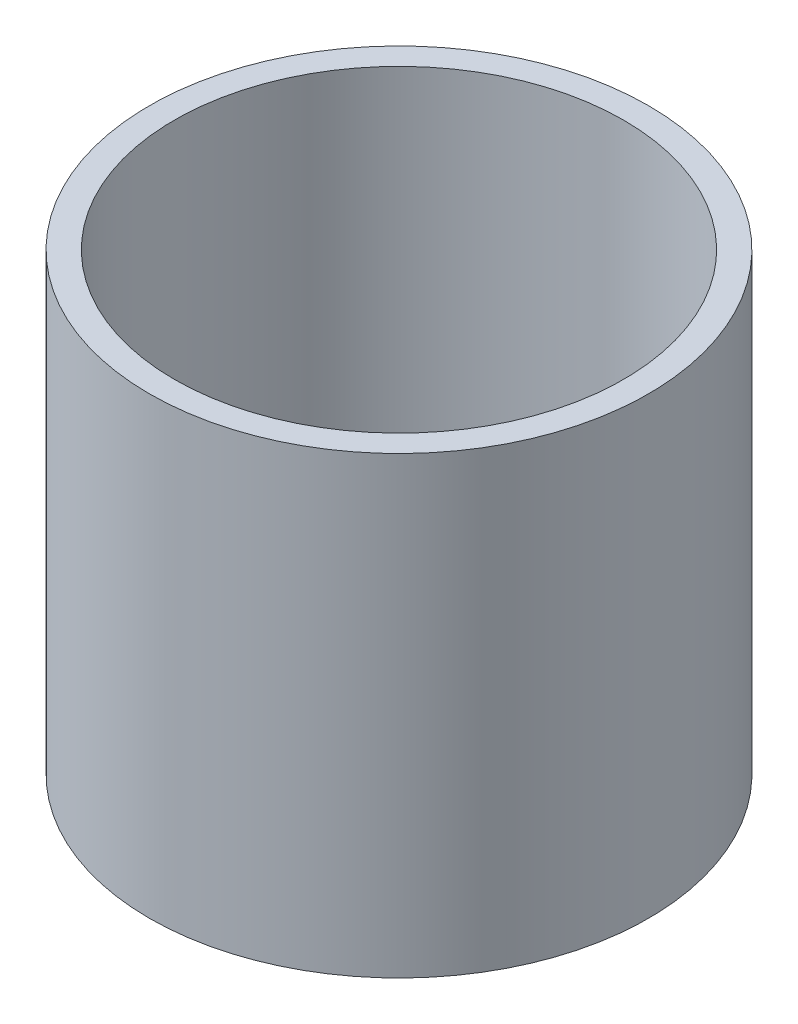
from build123d import *

# Parameters (mm, degrees)
SKETCH1_R           = 50
BOSS_EXTRUDE1_DEPTH = 13
SKETCH2_W           = 70
SKETCH2_H           = 55
CUT_EXTRUDE1_DEPTH  = 10
CUT_EXTRUDE3_START  = -10
CUT_EXTRUDE3_DEPTH  = 10
SKETCH6_R           = 50
BOSS_EXTRUDE5_DEPTH = 3
SKETCH11_W          = 40
SKETCH11_H          = 65
CUT_EXTRUDE12_DEPTH = 10
CUT_EXTRUDE13_START = -10
CUT_EXTRUDE13_DEPTH = 10
SKETCH13_R          = 50
BOSS_EXTRUDE6_DEPTH = 75
SKETCH14_R          = 45
CUT_EXTRUDE14_DEPTH = 75


with BuildPart() as part:
    # Sketch1 → Boss-Extrude1 (new body)
    with BuildSketch(Plane(origin=(0, 0, 0), x_dir=(1, 0, 0), z_dir=(0, 1, 0))):
        with Locations(Location((0, 0, 0), (0, 0, 90))):
            Circle(SKETCH1_R)
    extrude(amount=BOSS_EXTRUDE1_DEPTH)

    # Sketch2 → Cut-Extrude1 (cut)
    with BuildSketch(Plane(origin=(0, 13, 0), x_dir=(1, 0, 0), z_dir=(0, 1, 0))):
        with Locations((-0.015145616, 8.297810168)):
            Rectangle(SKETCH2_W, SKETCH2_H)
    extrude(amount=-CUT_EXTRUDE1_DEPTH, mode=Mode.SUBTRACT)

    # Sketch3 → Cut-Extrude3 (cut)
    with BuildSketch(Plane(origin=(0, 13, 0), x_dir=(1, 0, 0), z_dir=(0, 1, 0)).offset(CUT_EXTRUDE3_START)):
        with BuildLine():
            Line((-35.015145616, 35.692290169), (34.984854384, 35.72198152))
            ThreePointArc((34.984854384, 35.72198152), (-0.021208106, 49.999995502), (-35.015145616, 35.692290169))
        make_face()
    extrude(amount=CUT_EXTRUDE3_DEPTH, mode=Mode.SUBTRACT)

    # Sketch6 → Boss-Extrude5 (add)
    with BuildSketch(Plane(origin=(0, 13, 0), x_dir=(1, 0, 0), z_dir=(0, 1, 0))):
        with Locations(Location((0, 0, 0), (0, 0, 270))):
            Circle(SKETCH6_R)
    extrude(amount=BOSS_EXTRUDE5_DEPTH)

    # Sketch11 → Cut-Extrude12 (cut)
    with BuildSketch(Plane(origin=(0, 16, 0), x_dir=(1, 0, 0), z_dir=(0, 1, 0))):
        with Locations((0, 13.32575695)):
            Rectangle(SKETCH11_W, SKETCH11_H)
    extrude(amount=-CUT_EXTRUDE12_DEPTH, mode=Mode.SUBTRACT)

    # Sketch12 → Cut-Extrude13 (cut)
    with BuildSketch(Plane(origin=(0, 16, 0), x_dir=(1, 0, 0), z_dir=(0, 1, 0)).offset(CUT_EXTRUDE13_START)):
        with BuildLine():
            Line((-20, 45.82575695), (20, 45.82575695))
            ThreePointArc((20, 45.82575695), (0, 50), (-20, 45.82575695))
        make_face()
    extrude(amount=CUT_EXTRUDE13_DEPTH, mode=Mode.SUBTRACT)

    # Sketch13 → Boss-Extrude6 (add)
    with BuildSketch(Plane(origin=(0, 16, 0), x_dir=(1, 0, 0), z_dir=(0, 1, 0))):
        with Locations(Location((0, 0, 0), (0, 0, 270))):
            Circle(SKETCH13_R)
    extrude(amount=BOSS_EXTRUDE6_DEPTH)

    # Sketch14 → Cut-Extrude14 (cut)
    with BuildSketch(Plane(origin=(0, 91, 0), x_dir=(1, 0, 0), z_dir=(0, 1, 0))):
        with Locations(Location((0, 0, 0), (0, 0, 270))):
            Circle(SKETCH14_R)
    extrude(amount=-CUT_EXTRUDE14_DEPTH, mode=Mode.SUBTRACT)


solid = part.part
